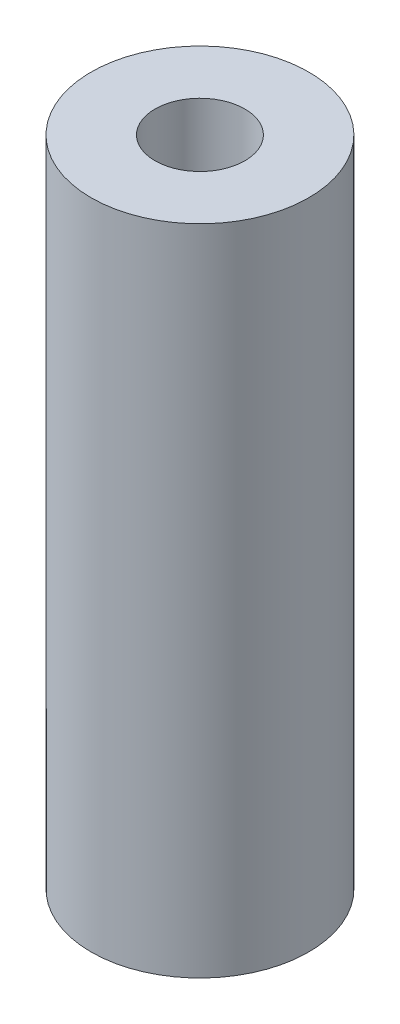
from build123d import *

# Parameters (mm, degrees)
SKETCH2_R           = 4
BOSS_EXTRUDE1_DEPTH = 24
SKETCH3_R           = 1.65
CUT_EXTRUDE1_DEPTH  = 8
CUT_EXTRUDE2_START  = -8
SKETCH4_R           = 1.65
CUT_EXTRUDE2_DEPTH  = 8


with BuildPart() as part:
    # Sketch2 → Boss-Extrude1 (new body)
    with BuildSketch(Plane(origin=(0, 0, 0), x_dir=(1, 0, 0), z_dir=(0, 1, 0))):
        with Locations(Location((0, 0, 0), (0, 0, 270))):
            Circle(SKETCH2_R)
    extrude(amount=BOSS_EXTRUDE1_DEPTH)

    # Sketch3 → Cut-Extrude1 (cut)
    with BuildSketch(Plane(origin=(0, 24, 0), x_dir=(1, 0, 0), z_dir=(0, 1, 0))):
        with Locations(Location((0, 0, 0), (0, 0, 270))):
            Circle(SKETCH3_R)
    extrude(amount=-CUT_EXTRUDE1_DEPTH, mode=Mode.SUBTRACT)

    # Sketch4 → Cut-Extrude2 (cut)
    with BuildSketch(Plane.XZ.offset(CUT_EXTRUDE2_START)):
        with Locations(Location((0, 0, 0), (0, 0, 90))):
            Circle(SKETCH4_R)
    extrude(amount=CUT_EXTRUDE2_DEPTH, mode=Mode.SUBTRACT)


solid = part.part
